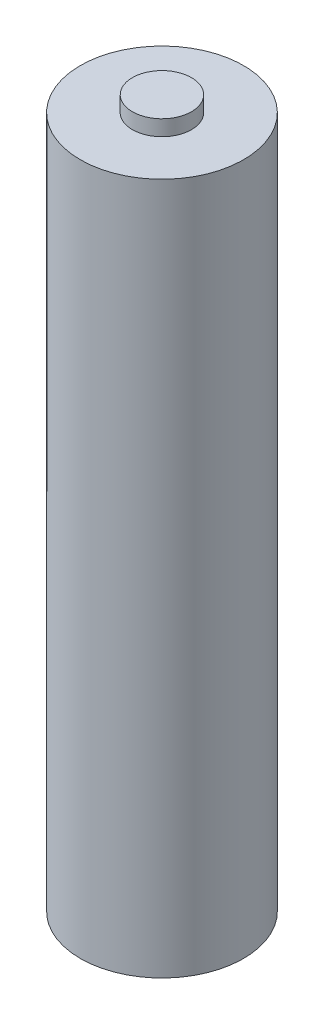
from build123d import *

# Parameters (mm, degrees)
SKETCH1_R           = 5.25
BOSS_EXTRUDE1_DEPTH = 44.5
SKETCH2_R           = 1.9
BOSS_EXTRUDE2_DEPTH = 1


with BuildPart() as part:
    # Sketch1 → Boss-Extrude1 (new body)
    with BuildSketch(Plane(origin=(0, 0, 0), x_dir=(1, 0, 0), z_dir=(0, 1, 0))):
        with Locations(Location((0, 0, 0), (0, 0, 270))):
            Circle(SKETCH1_R)
    extrude(amount=BOSS_EXTRUDE1_DEPTH)

    # Sketch2 → Boss-Extrude2 (add)
    with BuildSketch(Plane(origin=(0, 44.5, 0), x_dir=(1, 0, 0), z_dir=(0, 1, 0))):
        with Locations(Location((0, 0, 0), (0, 0, 270))):
            Circle(SKETCH2_R)
    extrude(amount=BOSS_EXTRUDE2_DEPTH)


solid = part.part
